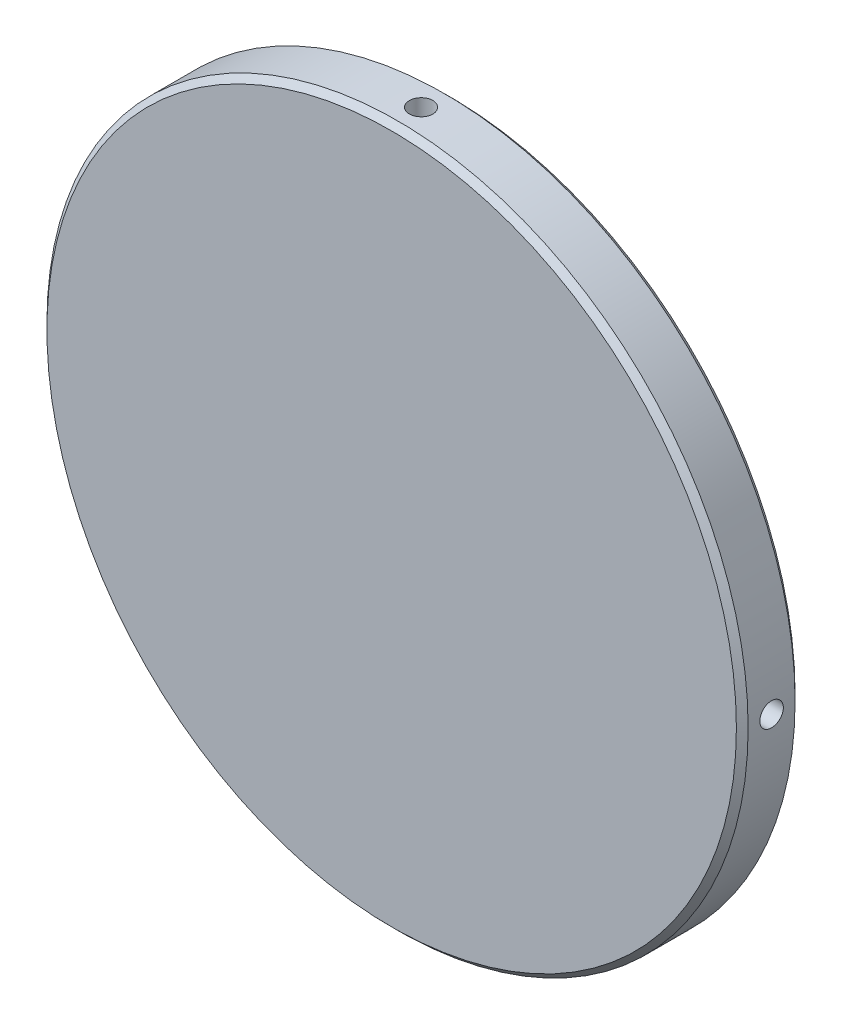
from build123d import *

# Parameters (mm, degrees)
SKETCH1_R           = 59.75
BOSS_EXTRUDE1_DEPTH = 5
CHAMFER1_SIZE       = 1
CUT_EXTRUDE1_START  = 54.5
SKETCH2_R           = 2
CUT_EXTRUDE1_DEPTH  = 17
CUT_EXTRUDE2_START  = -71.5
SKETCH2_2_R         = 2
CUT_EXTRUDE2_DEPTH  = 17
CUT_EXTRUDE3_START  = 54.5
SKETCH3_R           = 2
CUT_EXTRUDE3_DEPTH  = 16
CUT_EXTRUDE4_START  = -70.5
SKETCH3_2_R         = 2
CUT_EXTRUDE4_DEPTH  = 16


with BuildPart() as part:
    # Sketch1 → Boss-Extrude1 (new, symmetric)
    with BuildSketch(Plane.XY):
        Circle(SKETCH1_R)
    extrude(amount=BOSS_EXTRUDE1_DEPTH, both=True)

    # Chamfer1
    chamfer1_edges = [part.edges().sort_by_distance(p)[0] for p in [
        (-59.75, 0, -5),
        (-59.75, 0, 5),
    ]]
    chamfer(chamfer1_edges, length=CHAMFER1_SIZE)

    # Sketch2 → Cut-Extrude1 (cut)
    with BuildSketch(Plane(origin=(0, 0, 0), x_dir=(1, 0, 0), z_dir=(0, 1, 0)).offset(CUT_EXTRUDE1_START)):
        Circle(SKETCH2_R)
    extrude(amount=CUT_EXTRUDE1_DEPTH, mode=Mode.SUBTRACT)

    # Sketch2<2> → Cut-Extrude2 (cut)
    with BuildSketch(Plane(origin=(0, 0, 0), x_dir=(1, 0, 0), z_dir=(0, 1, 0)).offset(CUT_EXTRUDE2_START)):
        Circle(SKETCH2_2_R)
    extrude(amount=CUT_EXTRUDE2_DEPTH, mode=Mode.SUBTRACT)

    # Sketch3 → Cut-Extrude3 (cut)
    with BuildSketch(Plane(origin=(0, 0, 0), x_dir=(0, 0, -1), z_dir=(1, 0, 0)).offset(CUT_EXTRUDE3_START)):
        Circle(SKETCH3_R)
    extrude(amount=CUT_EXTRUDE3_DEPTH, mode=Mode.SUBTRACT)

    # Sketch3<2> → Cut-Extrude4 (cut)
    with BuildSketch(Plane(origin=(0, 0, 0), x_dir=(0, 0, -1), z_dir=(1, 0, 0)).offset(CUT_EXTRUDE4_START)):
        Circle(SKETCH3_2_R)
    extrude(amount=CUT_EXTRUDE4_DEPTH, mode=Mode.SUBTRACT)


solid = part.part
